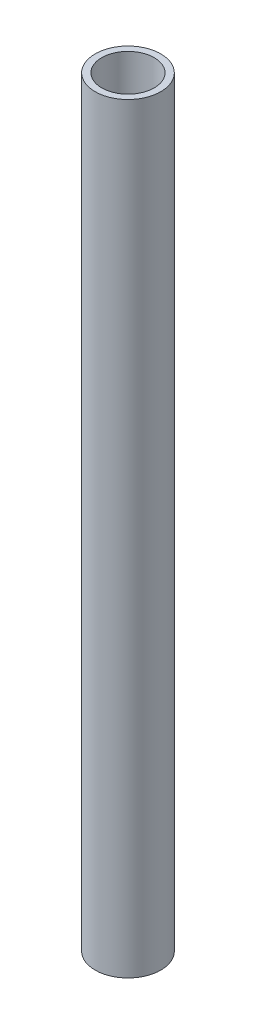
from build123d import *

# Parameters (mm, degrees)
SKETCH2_R           = 15.875
SKETCH2_R_2         = 12.7
BOSS_EXTRUDE1_DEPTH = 368.3


with BuildPart() as part:
    # Sketch2 → Boss-Extrude1 (new body)
    with BuildSketch(Plane(origin=(0, 0, 0), x_dir=(1, 0, 0), z_dir=(0, 1, 0))):
        with Locations(Location((0, 0, 0), (0, 0, 270))):
            Circle(SKETCH2_R)
        with Locations(Location((0, 0, 0), (0, 0, 270))):
            Circle(SKETCH2_R_2, mode=Mode.SUBTRACT)
    extrude(amount=BOSS_EXTRUDE1_DEPTH)


solid = part.part
